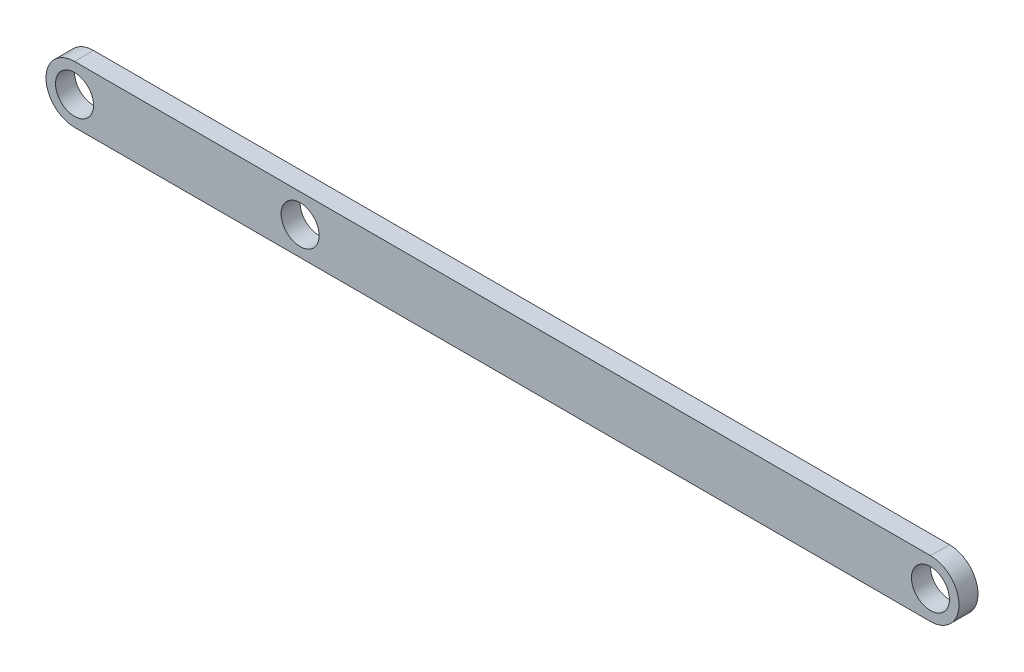
from build123d import *

# Parameters (mm, degrees)
EXTRUDE_2_DEPTH     = 10
SKETCH_2_R          = 10
CUT_EXTRUDE_1_DEPTH = 10
SKETCH_4_R          = 10
CUT_EXTRUDE_3_DEPTH = 10


with BuildPart() as part:
    # Эскиз1 → Бобышка-Вытянуть2 (new body)
    with BuildSketch(Plane.XY):
        with BuildLine():
            Line((0, 0), (-450, 0))
            ThreePointArc((-450, 0), (-465, 15), (-450, 30))
            Line((-450, 30), (0, 30))
            ThreePointArc((0, 30), (15, 15), (0, 0))
        make_face()
    extrude(amount=EXTRUDE_2_DEPTH)

    # Эскиз2 → Вырез-Вытянуть1 (cut)
    with BuildSketch(Plane(origin=(0, 0, 0), x_dir=(-1, 0, 0), z_dir=(0, 0, -1))):
        with Locations((0, 15)):
            Circle(SKETCH_2_R)
        with Locations((450, 15)):
            Circle(SKETCH_2_R)
    extrude(amount=-CUT_EXTRUDE_1_DEPTH, mode=Mode.SUBTRACT)

    # Эскиз4 → Вырез-Вытянуть3 (cut)
    with BuildSketch(Plane.XY.offset(10)):
        with Locations((-331.40838443, 15)):
            Circle(SKETCH_4_R)
    extrude(amount=-CUT_EXTRUDE_3_DEPTH, mode=Mode.SUBTRACT)


solid = part.part
